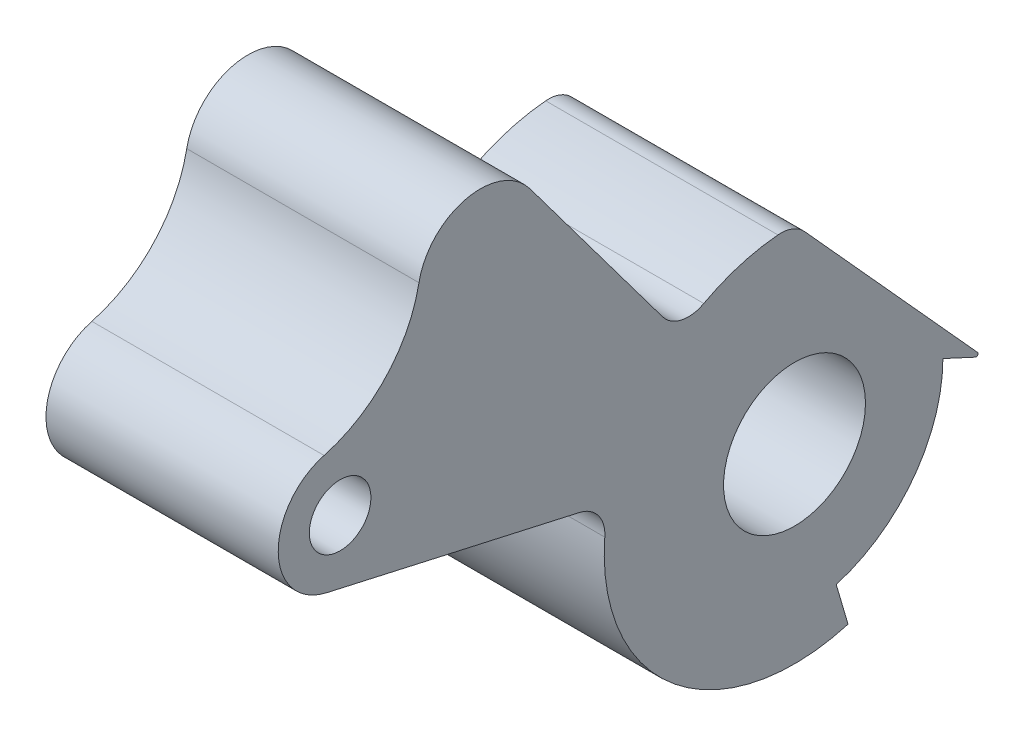
from build123d import *

# Parameters (mm, degrees)
SKETCH1_R           = 2.794
SKETCH1_R_2         = 1.212486465
BOSS_EXTRUDE1_DEPTH = 9.144
FILLET1_R           = 0.0762
FILLET2_R           = 1.27
FILLET3_R           = 1.27
FILLET4_R           = 1.27


with BuildPart() as part:
    # Sketch1 → Boss-Extrude1 (new body)
    with BuildSketch(Plane(origin=(0, 0, 0), x_dir=(0, 0, -1), z_dir=(1, 0, 0))):
        with BuildLine():
            Line((7.455728261, -0.746434927), (0, 7.493))
            ThreePointArc((0, 7.493), (-2.365682187, 7.109753638), (-4.489368086, 5.999218548))
            Line((-4.489368086, 5.999218548), (-10.410604044, 13.911866364))
            ThreePointArc((-10.410604044, 13.911866364), (-12.928407554, 14.83300033), (-14.787485141, 12.901251686))
            ThreePointArc((-14.787485141, 12.901251686), (-16.077348747, 10.353320901), (-18.523739382, 8.879932879))
            ThreePointArc((-18.523739382, 8.879932879), (-20.329518769, 6.475744872), (-18.427437803, 4.147001184))
            Line((-18.427437803, 4.147001184), (-7.310173579, 1.645117396))
            ThreePointArc((-7.310173579, 1.645117396), (-5.127063532, -5.464272005), (2.106798928, -7.190719524))
            Line((2.106798928, -7.190719524), (1.642588995, -5.606323697))
            ThreePointArc((1.642588995, -5.606323697), (4.675733574, -3.50235343), (5.842, 0))
            Line((5.842, 0), (7.455728261, -0.746434927))
        make_face()
        Circle(SKETCH1_R, mode=Mode.SUBTRACT)
        with Locations((-17.892205374, 6.525337206)):
            Circle(SKETCH1_R_2, mode=Mode.SUBTRACT)
    extrude(amount=BOSS_EXTRUDE1_DEPTH)

    # Fillet1
    fillet1_edges = [part.edges().sort_by_distance(p)[0] for p in [
        (4.572, -0.746434927, -7.455728261),
    ]]
    fillet(fillet1_edges, radius=FILLET1_R)

    # Fillet2
    fillet2_edges = [part.edges().sort_by_distance(p)[0] for p in [
        (4.572, 5.999218548, 4.489368086),
    ]]
    fillet(fillet2_edges, radius=FILLET2_R)

    # Fillet3
    fillet3_edges = [part.edges().sort_by_distance(p)[0] for p in [
        (4.572, 7.493, 0),
    ]]
    fillet(fillet3_edges, radius=FILLET3_R)

    # Fillet4
    fillet4_edges = [part.edges().sort_by_distance(p)[0] for p in [
        (4.572, 1.645117396, 7.310173579),
    ]]
    fillet(fillet4_edges, radius=FILLET4_R)


solid = part.part
